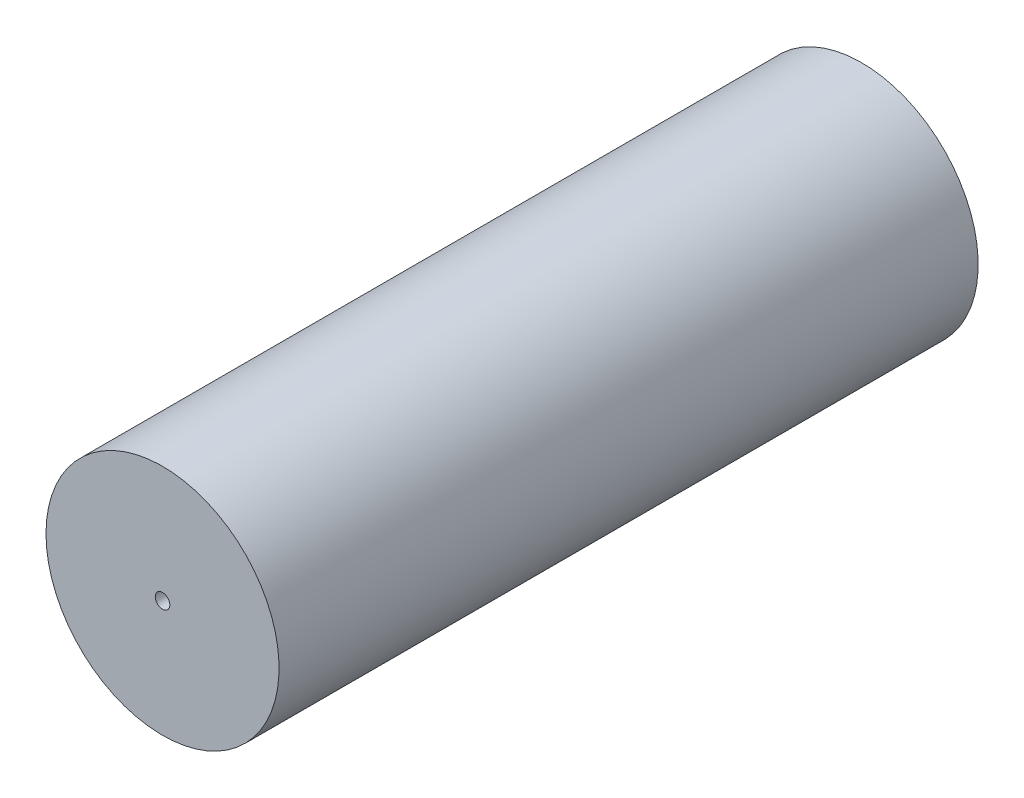
from build123d import *

# Parameters (mm, degrees)
SKETCH1_R           = 12.7
BOSS_EXTRUDE1_DEPTH = 76.2
SKETCH2_R           = 0.79375
CUT_EXTRUDE1_DEPTH  = 79.288057838


with BuildPart() as part:
    # Sketch1 → Boss-Extrude1 (new body)
    with BuildSketch(Plane.XY):
        with Locations(Location((0, 0, 0), (0, 0, 180))):
            Circle(SKETCH1_R)
    extrude(amount=BOSS_EXTRUDE1_DEPTH)

    # Sketch2 → Cut-Extrude1 (cut, through all)
    with BuildSketch(Plane.XY.offset(76.2)):
        Circle(SKETCH2_R)
    extrude(amount=-CUT_EXTRUDE1_DEPTH, mode=Mode.SUBTRACT)


solid = part.part
